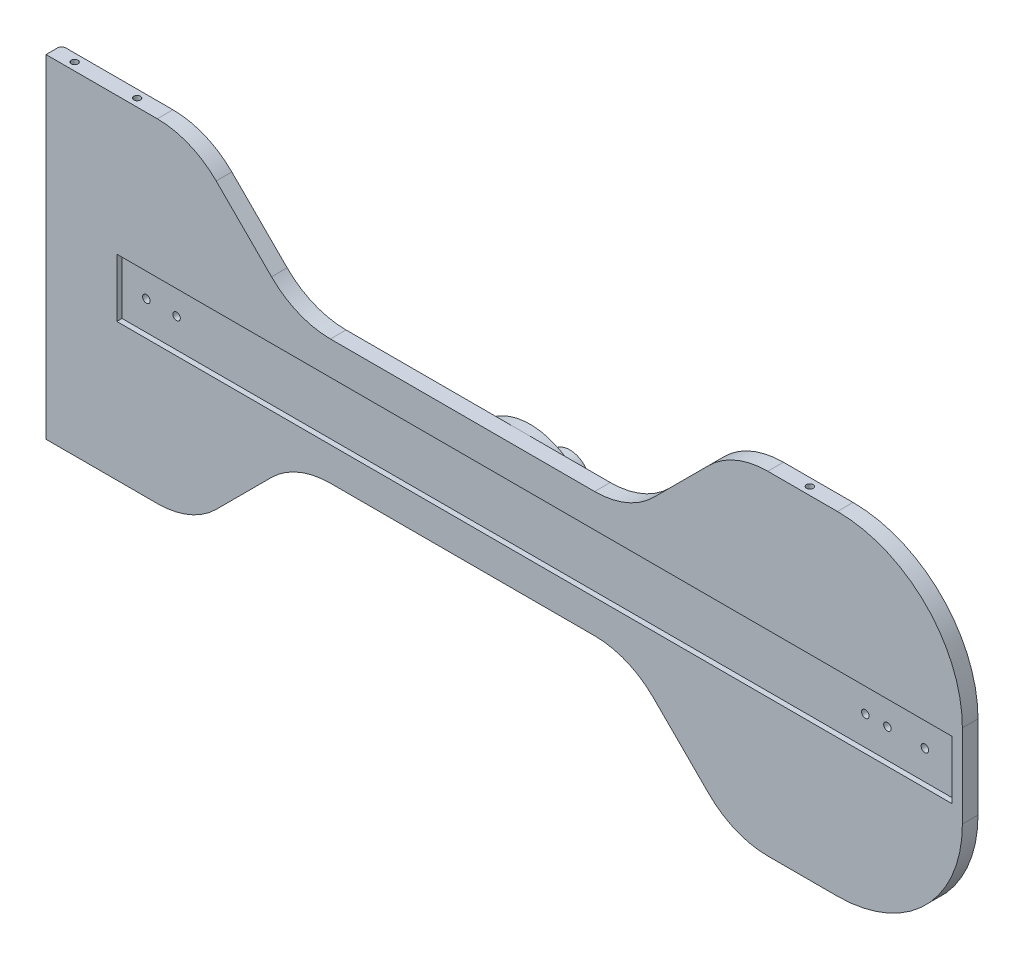
from build123d import *

# Parameters (mm, degrees)
BOSS_EXTRUDE1_DEPTH        = 9.525
SKETCH2_W                  = 509.27
SKETCH2_H                  = 35.56
CUT_EXTRUDE1_DEPTH         = 3.175
SKETCH3_R                  = 2.286
CUT_EXTRUDE2_DEPTH         = 595.632661817
F_10_32_TAPPED_HOLE1_D     = 4.0386
F_10_32_TAPPED_HOLE1_DEPTH = 13.716
F_10_32_TAPPED_HOLE1_TIP   = 1.213317848
F_10_32_TAPPED_HOLE2_D     = 4.0386
F_10_32_TAPPED_HOLE2_DEPTH = 13.716
F_10_32_TAPPED_HOLE2_TIP   = 1.213317848
SKETCH8_R                  = 38.1
BOSS_EXTRUDE2_DEPTH        = 6.35
SKETCH9_R                  = 20.447
BOSS_EXTRUDE3_DEPTH        = 5.08
SKETCH10_R                 = 12.573
BOSS_EXTRUDE4_DEPTH        = 19.05
F_10_24_TAPPED_HOLE1_D     = 3.7973
F_10_24_TAPPED_HOLE1_DEPTH = 14.986
F_10_24_TAPPED_HOLE1_TIP   = 1.140824014
FILLET2_R                  = 2.54


with BuildPart() as part:
    # Sketch1 → Boss-Extrude1 (new body)
    with BuildSketch(Plane.XY):
        with BuildLine():
            Line((103.778975516, 188.321024484), (137.521024484, 154.578975516))
            ThreePointArc((137.521024484, 154.578975516), (154.001730604, 143.566919748), (173.442048969, 139.7))
            Line((173.442048969, 139.7), (334.557951031, 139.7))
            ThreePointArc((334.557951031, 139.7), (353.998269396, 143.566919748), (370.478975516, 154.578975516))
            Line((370.478975516, 154.578975516), (404.221024484, 188.321024484))
            ThreePointArc((404.221024484, 188.321024484), (420.701730604, 199.333080252), (440.142048969, 203.2))
            Line((440.142048969, 203.2), (482.6, 203.2))
            ThreePointArc((482.6, 203.2), (536.481536726, 180.881536726), (558.8, 127))
            Line((558.8, 127), (558.8, 76.2))
            ThreePointArc((558.8, 76.2), (536.481536726, 22.318463274), (482.6, 0))
            Line((482.6, 0), (440.142048969, 0))
            ThreePointArc((440.142048969, 0), (420.701730604, 3.866919748), (404.221024484, 14.878975516))
            Line((404.221024484, 14.878975516), (370.478975516, 48.621024484))
            ThreePointArc((370.478975516, 48.621024484), (353.998269396, 59.633080252), (334.557951031, 63.5))
            Line((334.557951031, 63.5), (173.442048969, 63.5))
            ThreePointArc((173.442048969, 63.5), (154.001730604, 59.633080252), (137.521024484, 48.621024484))
            Line((137.521024484, 48.621024484), (103.778975516, 14.878975516))
            ThreePointArc((103.778975516, 14.878975516), (87.298269396, 3.866919748), (67.857951031, 0))
            Line((67.857951031, 0), (0, 0))
            Line((0, 0), (0, 203.2))
            Line((0, 203.2), (67.857951031, 203.2))
            ThreePointArc((67.857951031, 203.2), (87.298269396, 199.333080252), (103.778975516, 188.321024484))
        make_face()
    extrude(amount=BOSS_EXTRUDE1_DEPTH)

    # Sketch2 → Cut-Extrude1 (cut)
    with BuildSketch(Plane.XY.offset(9.525)):
        with Locations((297.815, 101.6)):
            Rectangle(SKETCH2_W, SKETCH2_H)
    extrude(amount=-CUT_EXTRUDE1_DEPTH, mode=Mode.SUBTRACT)

    # Sketch3 → Cut-Extrude2 (cut, through all)
    with BuildSketch(Plane.XY.offset(6.35)):
        with Locations((532.765, 101.6)):
            Circle(SKETCH3_R)
        with Locations((58.039, 101.6)):
            Circle(SKETCH3_R)
        with Locations((509.905, 101.6)):
            Circle(SKETCH3_R)
        with Locations((496.45, 101.6)):
            Circle(SKETCH3_R)
        with Locations((76.44999999, 101.6)):
            Circle(SKETCH3_R)
    extrude(amount=-CUT_EXTRUDE2_DEPTH, mode=Mode.SUBTRACT)

    # #10-32 Tapped Hole1
    with Locations(Plane(origin=(0, 203.2, 0), x_dir=(-1, 0, 0), z_dir=(0, 1, 0))):
        with Locations((-12.7, 4.7625), (-50.8, 4.7625), (-461.01, 4.7625)):
            Hole(F_10_32_TAPPED_HOLE1_D / 2, depth=F_10_32_TAPPED_HOLE1_DEPTH)
            with Locations((0, 0, -(F_10_32_TAPPED_HOLE1_DEPTH + F_10_32_TAPPED_HOLE1_TIP / 2))):  # 118° drill point
                Cone(0, F_10_32_TAPPED_HOLE1_D / 2, F_10_32_TAPPED_HOLE1_TIP, mode=Mode.SUBTRACT)

    # #10-32 Tapped Hole2
    with Locations(Plane.XZ):
        with Locations((12.7, 4.7625), (50.8, 4.7625), (461.01, 4.7625)):
            Hole(F_10_32_TAPPED_HOLE2_D / 2, depth=F_10_32_TAPPED_HOLE2_DEPTH)
            with Locations((0, 0, -(F_10_32_TAPPED_HOLE2_DEPTH + F_10_32_TAPPED_HOLE2_TIP / 2))):  # 118° drill point
                Cone(0, F_10_32_TAPPED_HOLE2_D / 2, F_10_32_TAPPED_HOLE2_TIP, mode=Mode.SUBTRACT)

    # Sketch8 → Boss-Extrude2 (add)
    with BuildSketch(Plane(origin=(0, 0, 0), x_dir=(-1, 0, 0), z_dir=(0, 0, -1))):
        with Locations(Location((-279.4, 101.6, 0), (0, 0, 270))):
            Circle(SKETCH8_R)
    extrude(amount=BOSS_EXTRUDE2_DEPTH)

    # Sketch9 → Boss-Extrude3 (add)
    with BuildSketch(Plane(origin=(0, 0, -6.35), x_dir=(-1, 0, 0), z_dir=(0, 0, -1))):
        with Locations((-279.4, 101.6)):
            Circle(SKETCH9_R)
    extrude(amount=BOSS_EXTRUDE3_DEPTH)

    # Sketch10 → Boss-Extrude4 (add)
    with BuildSketch(Plane(origin=(0, 0, -11.43), x_dir=(-1, 0, 0), z_dir=(0, 0, -1))):
        with Locations(Location((-279.4, 101.6, 0), (0, 0, 180))):
            Circle(SKETCH10_R)
    extrude(amount=BOSS_EXTRUDE4_DEPTH)

    # #10-24 Tapped Hole1
    with Locations(Plane(origin=(0, 0, -30.48), x_dir=(-1, 0, 0), z_dir=(0, 0, -1))):
        with Locations((-279.4, 101.6)):
            Hole(F_10_24_TAPPED_HOLE1_D / 2, depth=F_10_24_TAPPED_HOLE1_DEPTH)
            with Locations((0, 0, -(F_10_24_TAPPED_HOLE1_DEPTH + F_10_24_TAPPED_HOLE1_TIP / 2))):  # 118° drill point
                Cone(0, F_10_24_TAPPED_HOLE1_D / 2, F_10_24_TAPPED_HOLE1_TIP, mode=Mode.SUBTRACT)

    # Fillet2
    fillet2_edges = [part.edges().sort_by_distance(p)[0] for p in [
        (0, 101.6, 0),
    ]]
    fillet(fillet2_edges, radius=FILLET2_R)


solid = part.part
